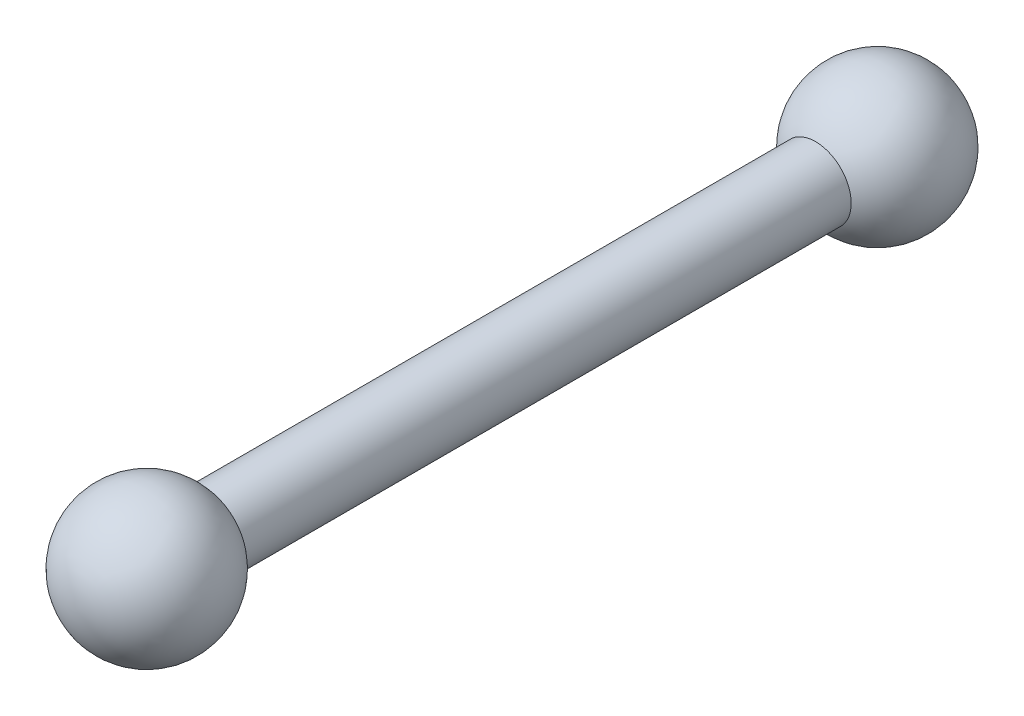
from build123d import *

# Parameters (mm, degrees)
SKETCH1_R           = 2
BOSS_EXTRUDE1_DEPTH = 35


with BuildPart() as part:
    # Sketch1 → Boss-Extrude1 (new body)
    with BuildSketch(Plane.XY):
        Circle(SKETCH1_R)
    extrude(amount=-BOSS_EXTRUDE1_DEPTH)

    # Sketch2 → Revolve1 (revolve)
    with BuildSketch(Plane.XY.offset(3)):
        with BuildLine():
            Line((0, 4), (0, -4))
            ThreePointArc((0, -4), (4, 0), (0, 4))
        make_face()
    revolve1 = revolve(axis=Axis((0, 4, 3), (0, -1, 0)))

    # Mirror1: Revolve1 across plane
    add(revolve1.mirror(Plane.XY.offset(-17.5)))


solid = part.part
